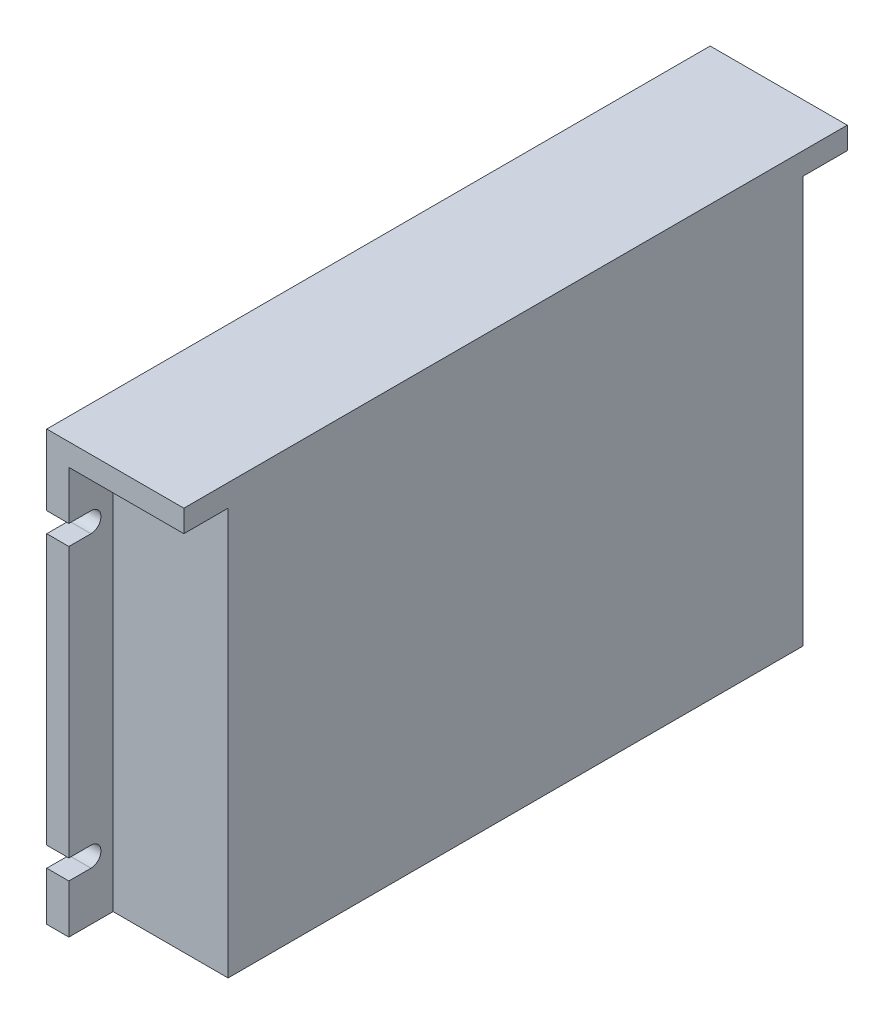
from build123d import *

# Parameters (mm, degrees)
SKETCH_1_W          = 150
SKETCH_1_H          = 97
EXTRUDE_1_DEPTH     = 31
SKETCH_2_W          = 10
SKETCH_2_H          = 92
CUT_EXTRUDE_1_DEPTH = 26
SKETCH_3_R          = 2.25
CUT_EXTRUDE_2_DEPTH = 26


with BuildPart() as part:
    # 草图1 → 凸台-拉伸1 (new body)
    with BuildSketch(Plane(origin=(0, 0, 0), x_dir=(0, 0, -1), z_dir=(1, 0, 0))):
        Rectangle(SKETCH_1_W, SKETCH_1_H)
    extrude(amount=EXTRUDE_1_DEPTH)

    # 草图2 → 切除-拉伸1 (cut)
    with BuildSketch(Plane(origin=(31, 0, 0), x_dir=(0, 0, -1), z_dir=(1, 0, 0))):
        with Locations((-70, -2.5)):
            Rectangle(SKETCH_2_W, SKETCH_2_H)
        with Locations((70, -2.5)):
            Rectangle(SKETCH_2_W, SKETCH_2_H)
    extrude(amount=-CUT_EXTRUDE_1_DEPTH, mode=Mode.SUBTRACT)

    # 草图3 → 切除-拉伸2 (cut)
    with BuildSketch(Plane(origin=(5, 0, 0), x_dir=(0, 0, -1), z_dir=(1, 0, 0))):
        with Locations((70, 30.25)):
            Circle(SKETCH_3_R)
        with Locations((70, -35.25)):
            Circle(SKETCH_3_R)
        with BuildLine():
            Line((-70, 32.5), (-75, 32.5))
            Line((-75, 32.5), (-75, 28))
            Line((-75, 28), (-70, 28))
            ThreePointArc((-70, 28), (-67.75, 30.25), (-70, 32.5))
        make_face()
        with BuildLine():
            Line((-70, -33), (-75, -33))
            Line((-75, -33), (-75, -37.5))
            Line((-75, -37.5), (-70, -37.5))
            ThreePointArc((-70, -37.5), (-67.75, -35.25), (-70, -33))
        make_face()
    extrude(amount=-CUT_EXTRUDE_2_DEPTH, mode=Mode.SUBTRACT)


solid = part.part
